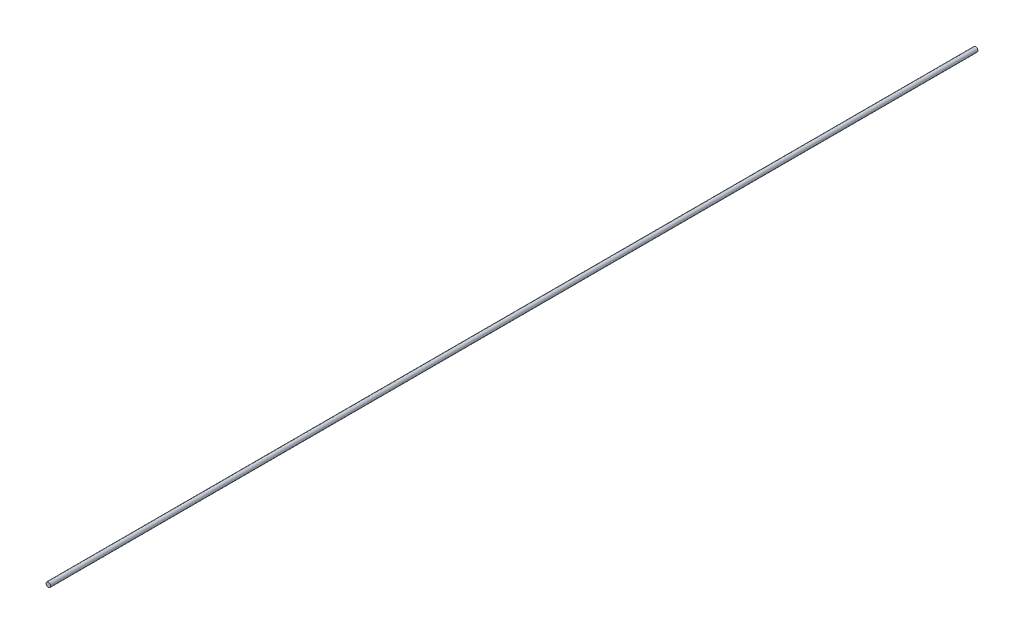
from build123d import *

# Parameters (mm, degrees)
SKETCH1_R           = 0.35
BOSS_EXTRUDE1_DEPTH = 140


with BuildPart() as part:
    # Sketch1 → Boss-Extrude1 (new body)
    with BuildSketch(Plane.XY):
        Circle(SKETCH1_R)
    extrude(amount=BOSS_EXTRUDE1_DEPTH)


solid = part.part
